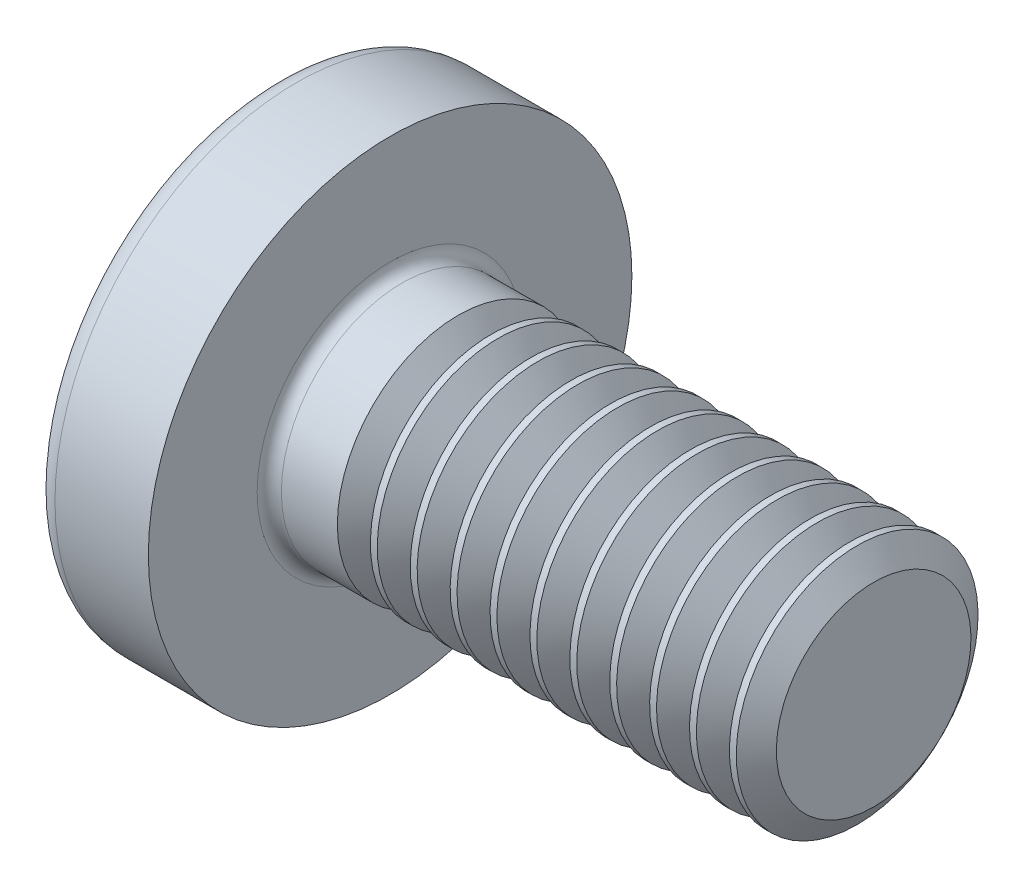
from build123d import *

# Parameters (mm, degrees)
FILLET1_R       = 0.2
RECPAT_COUNT    = 2
RECPAT_ANGLE    = 90
THDSCHPAT_COUNT = 11
THDSCHPAT_PITCH = 0.66


with BuildPart() as part:
    # BodySke → Base-Revolve (revolve)
    with BuildSketch(Plane.XY, mode=Mode.PRIVATE) as base_revolve_sk:
        with BuildLine():
            Line((3.1, 2), (3.1, 4))
            Line((3.1, 4), (1.555305874, 4))
            ThreePointArc((1.555305874, 4), (1.392873227, 3.961271902), (1.265388955, 3.853420195))
            ThreePointArc((1.265388955, 3.853420195), (0.324444487, 2.027933456), (0, 0))
            Line((0, 0), (11.1, 0))
            Line((11.1, 0), (11.1, 2))
            Line((11.1, 2), (3.1, 2))
        make_face()
    revolve(base_revolve_sk.sketch.rotate(Axis((1.555305874, 0, 0), (1, 0, 0)), 90), axis=Axis((1.555305874, 0, 0), (1, 0, 0)))

    # Fillet1
    fillet1_edges = [part.edges().sort_by_distance(p)[0] for p in [
        (3.1, 0, -2),
    ]]
    fillet(fillet1_edges, radius=FILLET1_R)

    # Sketch3 → Recess section 0
    with BuildSketch(Plane(origin=(0, 0, 0), x_dir=(0, 0, -1), z_dir=(1, 0, 0))):
        with BuildLine():
            Line((0.515, -2.15), (-0.515, -2.15))
            Line((-0.515, -2.15), (-0.515, 2.15))
            Line((-0.515, 2.15), (0.515, 2.15))
            Line((0.515, 2.15), (0.515, -2.15))
        make_face()
    # Sketch4 → Recess section 1
    with BuildSketch(Plane(origin=(2.34, 0, 0), x_dir=(0, 0, -1), z_dir=(1, 0, 0))):
        with BuildLine():
            Line((0.515, -0.983319232), (-0.515, -0.983319232))
            Line((-0.515, -0.983319232), (-0.515, 0.983319232))
            Line((-0.515, 0.983319232), (0.515, 0.983319232))
            Line((0.515, 0.983319232), (0.515, -0.983319232))
        make_face()
    recess = loft(mode=Mode.SUBTRACT)

    # RecPat: Recess ×2 about axis
    recpat_axis = Axis((0, 0, 0), (1, 0, 0))
    for i in range(1, RECPAT_COUNT):
        add(recess.rotate(recpat_axis, i * RECPAT_ANGLE / (RECPAT_COUNT - 1)), mode=Mode.SUBTRACT)

    # RecCorSke → RecessCore (revolve, cut)
    with BuildSketch(Plane.XY, mode=Mode.PRIVATE) as recesscore_sk:
        Polygon((0, 0), (0, 1.01462874), (2.34, 0.851), (2.616506661, 0), align=None)
    revolve(recesscore_sk.sketch.rotate(Axis((-3.175, 0, 0), (1, 0, 0)), 345.452408241), axis=Axis((-3.175, 0, 0), (1, 0, 0)), mode=Mode.SUBTRACT)

    # ThdSchSke → ThreadSchematic (revolve, cut)
    with BuildSketch(Plane.XY, mode=Mode.PRIVATE) as threadschematic_sk:
        Polygon((4.5, -1.61), (4.22691906, -2), (4.22691906, -2.5), (4.77308094, -2.5), (4.77308094, -2), align=None)
    threadschematic = revolve(threadschematic_sk.sketch.rotate(Axis((-3.175, 0, 0), (1, 0, 0)), 270), axis=Axis((-3.175, 0, 0), (1, 0, 0)), mode=Mode.SUBTRACT)

    # ThdSchPat: ThreadSchematic ×11
    with Locations(*[(i * THDSCHPAT_PITCH, 0, 0) for i in range(1, THDSCHPAT_COUNT)]):
        add(threadschematic, mode=Mode.SUBTRACT)


solid = part.part
